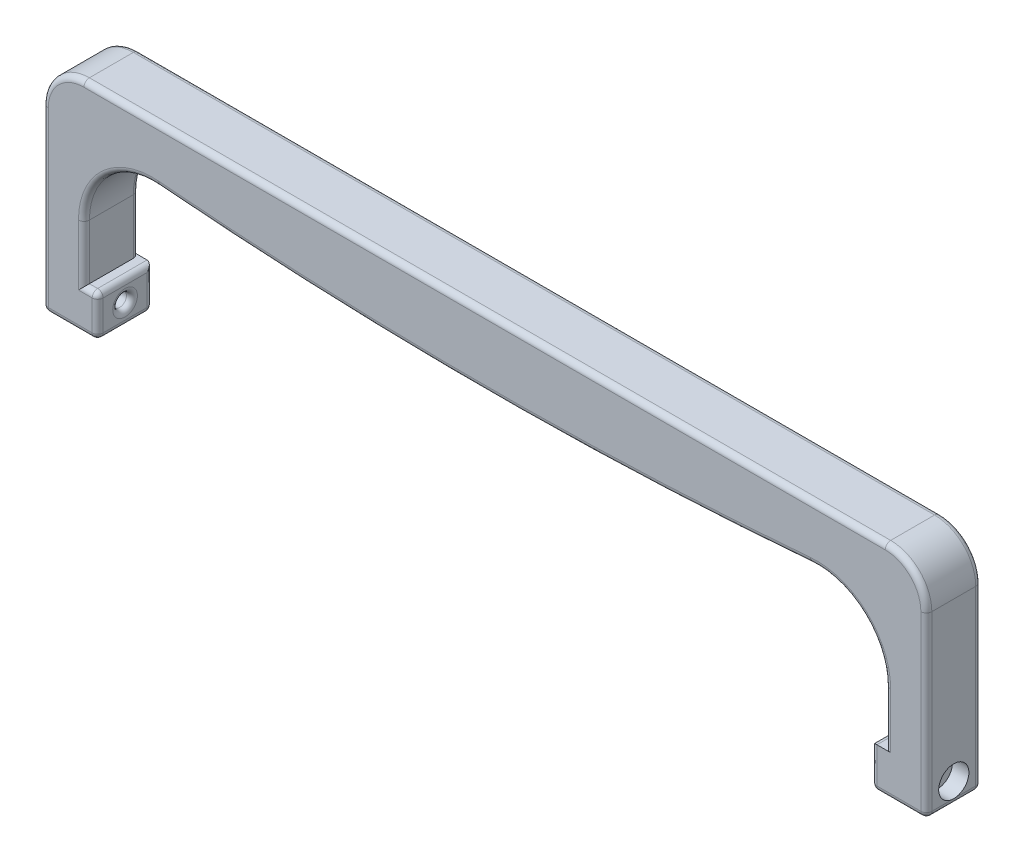
from build123d import *

# Parameters (mm, degrees)
BOSS_EXTRUDE1_DEPTH      = 20
FILLET7_R                = 15
CUT_EXTRUDE3_DEPTH       = 333.39133562714903
CUT_EXTRUDE3_DEPTH_BACK  = 333.39133562714903
SKETCH5_R                = 2.5
SKETCH6_R                = 5.5
CUT_EXTRUDE4_DEPTH       = 6
CUT_EXTRUDE5_START       = -6
SKETCH7_R                = 5.5
CUT_EXTRUDE5_DEPTH       = 6
FILLET2_R                = 2
FILLET3_R                = 2
BOSS_EXTRUDE2_DEPTH      = 1
BOSS_EXTRUDE2_DEPTH_BACK = 10


with BuildPart() as part:
    # Sketch1 → Boss-Extrude1 (new body)
    with BuildSketch(Plane.XY):
        with BuildLine():
            Line((-146.00000000000003, 15), (-146.00000000000003, 35.088261394563546))
            ThreePointArc((-146.00000000000003, 35.088261394563546), (-137.91933959730483, 53.49304195807679), (-118.90112419271411, 60))
            ThreePointArc((-118.90112419271411, 60), (8.672e-14, 55), (118.90112419271411, 60))
            ThreePointArc((118.90112419271411, 60), (137.91933959730483, 53.493041958076795), (146.00000000000003, 35.088261394563546))
            Line((146.00000000000003, 35.088261394563546), (146.00000000000003, 14.999999999999998))
            Line((146.00000000000003, 14.999999999999998), (141, 14.999999999999998))
            Line((141, 14.999999999999998), (141, -6.1e-16))
            Line((141, -6.1e-16), (146.00000000000003, -1.788e-14))
            Line((146.00000000000003, -1.788e-14), (161.00000000000003, -1.223e-14))
            Line((161.00000000000003, -1.223e-14), (161.00000000000003, 28.577779898868368))
            Line((161.00000000000003, 28.577779898868368), (161.00000000000003, 80.00000000000001))
            Line((161.00000000000003, 80.00000000000001), (84.84499999999998, 80.00000000000001))
            Line((84.84499999999998, 80.00000000000001), (-146.00000000000003, 79.99999999999997))
            Line((-146.00000000000003, 79.99999999999997), (-161.00000000000003, 79.99999999999997))
            Line((-161.00000000000003, 79.99999999999997), (-161.00000000000003, 28.577779898868233))
            Line((-161.00000000000003, 28.577779898868233), (-161.00000000000003, -1.223e-14))
            Line((-161.00000000000003, -1.223e-14), (-146.00000000000003, -1.788e-14))
            Line((-146.00000000000003, -1.788e-14), (-141, -1.727e-14))
            Line((-141, -1.727e-14), (-141, 15))
            Line((-141, 15), (-146.00000000000003, 15))
        make_face()
    extrude(amount=BOSS_EXTRUDE1_DEPTH)

    # Fillet7
    fillet7_edges = [part.edges().sort_by_distance(p)[0] for p in [
        (161.00000000000003, 80.00000000000001, 10),
        (-161.00000000000003, 79.99999999999997, 10),
    ]]
    fillet(fillet7_edges, radius=FILLET7_R)

    # Sketch5 → Cut-Extrude3 (cut, two sides: drawn at the far end of the back side and taken through both)
    with BuildSketch(Plane.ZY.offset(161.00000000000003).offset(-CUT_EXTRUDE3_DEPTH_BACK)):
        with Locations((10, 7.499999999999994)):
            Circle(SKETCH5_R)
    extrude(amount=CUT_EXTRUDE3_DEPTH + CUT_EXTRUDE3_DEPTH_BACK, mode=Mode.SUBTRACT)

    # Sketch6 → Cut-Extrude4 (cut)
    with BuildSketch(Plane.ZY.offset(161.00000000000003)):
        with Locations((10, 7.499999999999994)):
            Circle(SKETCH6_R)
    extrude(amount=-CUT_EXTRUDE4_DEPTH, mode=Mode.SUBTRACT)

    # Sketch7 → Cut-Extrude5 (cut)
    with BuildSketch(Plane(origin=(161.00000000000003, 0, 0), x_dir=(0, 0, -1), z_dir=(1, 0, 0)).offset(CUT_EXTRUDE5_START)):
        with Locations((-10, 7.499999999999994)):
            Circle(SKETCH7_R)
    extrude(amount=CUT_EXTRUDE5_DEPTH, mode=Mode.SUBTRACT)

    # Fillet2
    fillet2_edges = [part.edges().sort_by_distance(p)[0] for p in [
        (146.00000000000003, 25.044130697281773, 20),
        (137.91933959730483, 53.49304195807679, 20),
        (3.55e-15, 55, 20),
        (-137.91933959730483, 53.49304195807679, 20),
        (146.00000000000003, 25.044130697281773, 0),
        (137.91933959730483, 53.49304195807679, 0),
        (3.55e-15, 55, 0),
        (-137.91933959730483, 53.49304195807679, 0),
        (161.00000000000003, 32.5, 20),
        (161.00000000000003, 32.5, 0),
        (-146.00000000000003, 25.044130697281773, 20),
        (-146.00000000000003, 25.044130697281773, 0),
        (-161.00000000000003, 32.5, 0),
        (-161.00000000000003, 32.5, 20),
        (156.60660171779824, 75.60660171779823, 0),
        (0, 80, 0),
        (-156.60660171779824, 75.60660171779823, 0),
        (156.60660171779824, 75.60660171779823, 20),
        (0, 80, 20),
        (-156.60660171779824, 75.60660171779823, 20),
    ]]
    fillet(fillet2_edges, radius=FILLET2_R)

    # Fillet3
    fillet3_edges = [part.edges().sort_by_distance(p)[0] for p in [
        (150, -5.84e-15, 0),
        (160.41421356237313, -6.278e-14, 0.5857864376269046),
        (161.00000000000003, -1.223e-14, 10),
        (160.41421356237313, -7.105e-14, 19.414213562373096),
        (-150, -1.5e-14, 0),
        (-160.41421356237313, -1.421e-14, 0.5857864376269049),
        (-161.00000000000003, -1.223e-14, 10),
        (-160.41421356237313, -1.298e-14, 19.414213562373096),
        (141, 14.999999999999998, 10),
        (141, 7.499999999999999, 20),
        (141, -6.1e-16, 10),
        (141, 7.499999999999999, 0),
        (140.99999999999997, 7.499999999999994, 7.5),
        (-141, -1.727e-14, 10),
        (-141, 7.499999999999992, 20),
        (-141, 15, 10),
        (-141, 7.499999999999992, 0),
        (-141, 7.499999999999994, 7.5),
        (144.5, 15, -2.2e-16),
        (150, -5.84e-15, 20),
        (-150, -1.5e-14, 20),
        (-144.5, 15, 20),
    ]]
    fillet(fillet3_edges, radius=FILLET3_R)

    # Sketch8 → Boss-Extrude2 (add, two sides: drawn at the far end of the back side and taken through both)
    # profile 1 of 9: a face of its own
    with BuildSketch(Plane(origin=(1e-17, 1e-17, -0.200000000000006), x_dir=(-1, 0, -5e-17), z_dir=(5e-17, 4e-17, -1)).offset(-BOSS_EXTRUDE2_DEPTH_BACK)):
        with BuildLine():
            Line((-30.517022519889416, 73.74602396791785), (-31.881612061563306, 72.17358700414518))
            Line((-31.881612061563306, 72.17358700414518), (-33.036250841802335, 70.84974614655205))
            Line((-33.036250841802335, 70.84974614655205), (-34.08071072361279, 69.6561283548446))
            ThreePointArc((-34.08071072361279, 69.6561283548446), (-34.09167199181621, 69.64798574838517), (-34.10501822003159, 69.64509963802631))
            ThreePointArc((-34.10501822003159, 69.64509963802631), (-34.11872671725561, 69.64755721049654), (-34.13072778087494, 69.65462382429612))
            Line((-34.13072778087494, 69.65462382429612), (-35.06952265457502, 70.46082136022505))
            Line((-35.06952265457502, 70.46082136022505), (-36.10960574628801, 71.35727611334067))
            Line((-36.10960574628801, 71.35727611334067), (-37.338076283696616, 72.42202461248611))
            Line((-37.338076283696616, 72.42202461248611), (-38.5665683359056, 73.48775835033963))
            Line((-38.5665683359056, 73.48775835033963), (-39.60682239535434, 74.38734433646418))
            Line((-39.60682239535434, 74.38734433646418), (-40.544864829487096, 75.1968540615666))
            ThreePointArc((-40.544864829487096, 75.1968540615666), (-40.55762979171378, 75.20607437847566), (-40.57178971911695, 75.21296313456725))
            ThreePointArc((-40.57178971911695, 75.21296313456725), (-40.58296829963571, 75.21386586393531), (-40.592857953609936, 75.20857716589173))
            ThreePointArc((-40.592857953609936, 75.20857716589173), (-40.606947440180576, 75.19315015471757), (-40.61929940246347, 75.17629977391019))
            ThreePointArc((-40.61929940246347, 75.17629977391019), (-40.63614179688674, 75.1484867485354), (-40.65103916527198, 75.11958520799512))
            Line((-40.65103916527198, 75.11958520799512), (-40.69021223809995, 75.03172925296559))
            Line((-40.69021223809995, 75.03172925296559), (-42.278492497513106, 71.24151479320118))
            Line((-42.278492497513106, 71.24151479320118), (-44.770546020938646, 65.28659821768929))
            Line((-44.770546020938646, 65.28659821768929), (-47.60344758237721, 58.51521112987346))
            ThreePointArc((-47.60344758237721, 58.51521112987346), (-47.612762094503886, 58.49097474351078), (-47.620640209230714, 58.46623413178775))
            ThreePointArc((-47.620640209230714, 58.46623413178775), (-47.622682953143745, 58.45735232131227), (-47.62377639278466, 58.44830446246234))
            ThreePointArc((-47.62377639278466, 58.44830446246234), (-47.62361241781412, 58.44065800603708), (-47.6220999777339, 58.433160825990015))
            ThreePointArc((-47.6220999777339, 58.433160825990015), (-47.61972282359854, 58.427778100172624), (-47.616060205956, 58.423172686943275))
            ThreePointArc((-47.616060205956, 58.423172686943275), (-47.611784824398065, 58.42038253933098), (-47.60677408093159, 58.41940465330618))
            ThreePointArc((-47.60677408093159, 58.41940465330618), (-47.59660378079961, 58.42160996975596), (-47.588260372863886, 58.42782977436996))
            Line((-47.588260372863886, 58.42782977436996), (-46.540995921960246, 59.62994667204537))
            Line((-46.540995921960246, 59.62994667204537), (-45.384897881652215, 60.960250184986876))
            Line((-45.384897881652215, 60.960250184986876), (-44.016900277853416, 62.540398759677835))
            Line((-44.016900277853416, 62.540398759677835), (-42.64929269670946, 64.12055755657687))
            Line((-42.64929269670946, 64.12055755657687), (-41.494434005239654, 65.45085084731224))
            Line((-41.494434005239654, 65.45085084731224), (-40.447338078705364, 66.6546670558046))
            ThreePointArc((-40.447338078705364, 66.6546670558046), (-40.4406855672402, 66.65963221191005), (-40.432573306094135, 66.66139286606227))
            ThreePointArc((-40.432573306094135, 66.66139286606227), (-40.42423280221929, 66.65988919736115), (-40.41694252076583, 66.65556752861187))
            Line((-40.41694252076583, 66.65556752861187), (-39.47078316174019, 65.83657940119984))
            Line((-39.47078316174019, 65.83657940119984), (-38.425880058986, 64.9301596561797))
            Line((-38.425880058986, 64.9301596561797), (-37.188912138769126, 63.85351727229109))
            Line((-37.188912138769126, 63.85351727229109), (-35.60063238779016, 62.47196799344987))
            Line((-35.60063238779016, 62.47196799344987), (-34.66066261288131, 61.662692067863716))
            Line((-34.66066261288131, 61.662692067863716), (-33.97174080184667, 61.07533657193179))
            ThreePointArc((-33.97174080184667, 61.07533657193179), (-33.954050801530904, 61.06936025676506), (-33.93710325766889, 61.077198190879926))
            ThreePointArc((-33.93710325766889, 61.077198190879926), (-33.918071543720195, 61.101328397601385), (-33.9036837807438, 61.1284847097365))
            Line((-33.9036837807438, 61.1284847097365), (-30.41571960064513, 69.44990128602949))
            Line((-30.41571960064513, 69.44990128602949), (-26.926800706983364, 77.77378339228738))
            ThreePointArc((-26.926800706983364, 77.77378339228738), (-26.91857896521943, 77.80058280495462), (-26.915802041310265, 77.82847714578826))
            ThreePointArc((-26.915802041310265, 77.82847714578826), (-26.91628310524661, 77.83212386207289), (-26.917693390287262, 77.83552107538318))
            ThreePointArc((-26.917693390287262, 77.83552107538318), (-26.920050789000157, 77.83878922391445), (-26.92301185429802, 77.84152239346932))
            ThreePointArc((-26.92301185429802, 77.84152239346932), (-26.926812118481564, 77.84389103801517), (-26.93096767425751, 77.84555952266966))
            ThreePointArc((-26.93096767425751, 77.84555952266966), (-26.935605763254234, 77.84659921986893), (-26.940346120254198, 77.84694829768345))
            ThreePointArc((-26.940346120254198, 77.84694829768345), (-26.949504077333067, 77.84496389925708), (-26.95701921565091, 77.8393666936117))
            Line((-26.95701921565091, 77.8393666936117), (-28.001119251599146, 76.6423017891643))
            Line((-28.001119251599146, 76.6423017891643), (-29.153229052668816, 75.31848177739387))
            ThreePointArc((-29.153229052668816, 75.31848177739387), (-29.83537737952861, 74.53247107961056), (-30.517022519889416, 73.74602396791785))
        make_face()
    # profile 2 of 9: a face of its own
    with BuildSketch(Plane(origin=(1e-17, 1e-17, -0.200000000000006), x_dir=(-1, 0, -5e-17), z_dir=(5e-17, 4e-17, -1)).offset(-BOSS_EXTRUDE2_DEPTH_BACK)):
        with BuildLine():
            Line((-25.194575700847825, 71.801086874867), (-25.227873841661587, 70.31216477346783))
            Line((-25.227873841661587, 70.31216477346783), (-26.529654081214108, 67.24914457303491))
            Line((-26.529654081214108, 67.24914457303491), (-27.029758257584028, 66.07227059445927))
            Line((-27.029758257584028, 66.07227059445927), (-27.453071642457253, 65.07575829175823))
            Line((-27.453071642457253, 65.07575829175823), (-27.833703249137812, 64.17951483325015))
            Line((-27.833703249137812, 64.17951483325015), (-27.845171440542106, 64.15164519234153))
            ThreePointArc((-27.845171440542106, 64.15164519234153), (-27.843842865329282, 64.13850452208453), (-27.83231738953594, 64.13205427134237))
            Line((-27.83231738953594, 64.13205427134237), (-27.614904594399732, 64.12546089649939))
            Line((-27.614904594399732, 64.12546089649939), (-27.278222587072563, 64.12212698550762))
            Line((-27.278222587072563, 64.12212698550762), (-26.63139418866299, 64.12488500095293))
            Line((-26.63139418866299, 64.12488500095293), (-25.403879775406466, 64.13260445246493))
            Line((-25.403879775406466, 64.13260445246493), (-25.250700631572183, 64.20782461001262))
            ThreePointArc((-25.250700631572183, 64.20782461001262), (-25.217687602892184, 64.22513663176431), (-25.18563829634145, 64.24417365120999))
            ThreePointArc((-25.18563829634145, 64.24417365120999), (-25.150757396494733, 64.26709676174967), (-25.116768269595287, 64.29132247997522))
            ThreePointArc((-25.116768269595287, 64.29132247997522), (-25.08508546399332, 64.3157754121767), (-25.054363065733263, 64.34142458973103))
            ThreePointArc((-25.054363065733263, 64.34142458973103), (-25.03125292833814, 64.36308417965613), (-25.0098633136667, 64.38644441660595))
            ThreePointArc((-25.0098633136667, 64.38644441660595), (-24.972694312373054, 64.43701386235885), (-24.942874437247095, 64.4922368516694))
            Line((-24.942874437247095, 64.4922368516694), (-24.735598075363207, 64.949285141681))
            Line((-24.735598075363207, 64.949285141681), (-24.45395761738369, 65.58842290877762))
            Line((-24.45395761738369, 65.58842290877762), (-24.039131152275203, 66.55165558837808))
            Line((-24.039131152275203, 66.55165558837808), (-23.699391394080635, 67.34228578177328))
            Line((-23.699391394080635, 67.34228578177328), (-23.410821404231918, 68.00801450417856))
            Line((-23.410821404231918, 68.00801450417856), (-23.149294715694623, 68.60795760336822))
            ThreePointArc((-23.149294715694623, 68.60795760336822), (-23.145665954596673, 68.61235309826671), (-23.1402603727056, 68.61416085016549))
            ThreePointArc((-23.1402603727056, 68.61416085016549), (-23.134825906736065, 68.61276351696985), (-23.13109127866276, 68.60857561611289))
            Line((-23.13109127866276, 68.60857561611289), (-22.835810827794738, 67.96947552926136))
            Line((-22.835810827794738, 67.96947552926136), (-22.51000192961861, 67.26063315383296))
            Line((-22.51000192961861, 67.26063315383296), (-22.126024477118758, 66.41851579526681))
            Line((-22.126024477118758, 66.41851579526681), (-21.620113231339946, 65.31020172525088))
            Line((-21.620113231339946, 65.31020172525088), (-21.322786771247664, 64.67373479049049))
            Line((-21.322786771247664, 64.67373479049049), (-21.113851379945263, 64.23946384284635))
            ThreePointArc((-21.113851379945263, 64.23946384284635), (-21.090737801675647, 64.20472919457747), (-21.059220458224615, 64.17739075364574))
            ThreePointArc((-21.059220458224615, 64.17739075364574), (-21.023863025121436, 64.15991566791031), (-20.985349444572286, 64.15141679678581))
            ThreePointArc((-20.985349444572286, 64.15141679678581), (-20.899319004140487, 64.14440046209126), (-20.813117740797388, 64.13994986308782))
            ThreePointArc((-20.813117740797388, 64.13994986308782), (-20.663197965565555, 64.13568148221127), (-20.51322826317889, 64.13387969228837))
            Line((-20.51322826317889, 64.13387969228837), (-19.83902123766232, 64.13260271930952))
            Line((-19.83902123766232, 64.13260271930952), (-18.68719075434874, 64.13260271930952))
            Line((-18.68719075434874, 64.13260271930952), (-18.51744561560239, 64.22463094003348))
            ThreePointArc((-18.51744561560239, 64.22463094003348), (-18.482303458034874, 64.24457805871911), (-18.44796420994451, 64.26587770244728))
            ThreePointArc((-18.44796420994451, 64.26587770244728), (-18.413338940044188, 64.28917796037776), (-18.37955841050873, 64.31368688037846))
            ThreePointArc((-18.37955841050873, 64.31368688037846), (-18.3500671019475, 64.33673289062989), (-18.321424429720146, 64.36082548693747))
            ThreePointArc((-18.321424429720146, 64.36082548693747), (-18.302919484645656, 64.37877258063936), (-18.286407887883147, 64.3985690029653))
            ThreePointArc((-18.286407887883147, 64.3985690029653), (-18.252048135692686, 64.45071184470648), (-18.224151107950142, 64.5065797635738))
            Line((-18.224151107950142, 64.5065797635738), (-16.713731049154497, 68.04589805331781))
            Line((-16.713731049154497, 68.04589805331781), (-15.222493403982378, 71.54198383737773))
            ThreePointArc((-15.222493403982378, 71.54198383737773), (-15.181801611077226, 71.64674736599228), (-15.148018691453188, 71.75393847233644))
            ThreePointArc((-15.148018691453188, 71.75393847233644), (-15.151158888249334, 71.7734864005924), (-15.168063420864131, 71.783792666264))
            ThreePointArc((-15.168063420864131, 71.783792666264), (-15.238167294449251, 71.79047082211542), (-15.308486134481148, 71.79426708261528))
            ThreePointArc((-15.308486134481148, 71.79426708261528), (-15.449595441491912, 71.79761169652794), (-15.590743095009977, 71.79821408645769))
            Line((-15.590743095009977, 71.79821408645769), (-16.34889072420355, 71.79408421360422))
            Line((-16.34889072420355, 71.79408421360422), (-17.56328330351177, 71.78588367616983))
            Line((-17.56328330351177, 71.78588367616983), (-17.695506951477714, 71.72032302176873))
            ThreePointArc((-17.695506951477714, 71.72032302176873), (-17.802334592565398, 71.65585034668128), (-17.89708974002304, 71.57466948216523))
            ThreePointArc((-17.89708974002304, 71.57466948216523), (-17.981687678970637, 71.47563359681875), (-18.051028752355027, 71.3653760192903))
            ThreePointArc((-18.051028752355027, 71.3653760192903), (-18.15301148573282, 71.16310087263345), (-18.246144045493562, 70.95660138310706))
            Line((-18.246144045493562, 70.95660138310706), (-18.80587480530798, 69.63171799428814))
            Line((-18.80587480530798, 69.63171799428814), (-19.098449411319155, 68.93682470223517))
            Line((-19.098449411319155, 68.93682470223517), (-19.349111607329487, 68.34620701131271))
            Line((-19.349111607329487, 68.34620701131271), (-19.573236313915658, 67.82104320358061))
            ThreePointArc((-19.573236313915658, 67.82104320358061), (-19.580906661893607, 67.80594189575936), (-19.590508015688652, 67.79198848250965))
            ThreePointArc((-19.590508015688652, 67.79198848250965), (-19.597563453819166, 67.78475721913398), (-19.60596045912192, 67.77913932992473))
            ThreePointArc((-19.60596045912192, 67.77913932992473), (-19.61842512099299, 67.77321753446356), (-19.631343535002443, 67.76836469647692))
            ThreePointArc((-19.631343535002443, 67.76836469647692), (-19.646310856300243, 67.76409369402741), (-19.661567253654688, 67.76101075573439))
            ThreePointArc((-19.661567253654688, 67.76101075573439), (-19.676924496648894, 67.75915782715414), (-19.692380729379, 67.75853885502275))
            ThreePointArc((-19.692380729379, 67.75853885502275), (-19.707631947234653, 67.75915813035074), (-19.72278274792565, 67.76101187964183))
            ThreePointArc((-19.72278274792565, 67.76101187964183), (-19.737441351992313, 67.76406456497033), (-19.751783681995633, 67.76836469647692))
            ThreePointArc((-19.751783681995633, 67.76836469647692), (-19.763833163830295, 67.77319631286137), (-19.77537508878884, 67.77913924964562))
            ThreePointArc((-19.77537508878884, 67.77913924964562), (-19.7828236579285, 67.7847441273493), (-19.78869010102561, 67.79198848250968))
            ThreePointArc((-19.78869010102561, 67.79198848250968), (-19.796630266415477, 67.80567672714416), (-19.80366361759115, 67.81985227788589))
            Line((-19.80366361759115, 67.81985227788589), (-20.05978520350341, 68.38121592626077))
            Line((-20.05978520350341, 68.38121592626077), (-20.346168765141424, 69.01029763818704))
            Line((-20.346168765141424, 69.01029763818704), (-20.682237627416974, 69.75089735754851))
            Line((-20.682237627416974, 69.75089735754851), (-21.12514652658429, 70.72349435402307))
            Line((-21.12514652658429, 70.72349435402307), (-21.38734841592241, 71.28423668409354))
            Line((-21.38734841592241, 71.28423668409354), (-21.570183945967244, 71.66127414168082))
            ThreePointArc((-21.570183945967244, 71.66127414168082), (-21.595062868386215, 71.69963456532909), (-21.628220762277998, 71.73111530477189))
            ThreePointArc((-21.628220762277998, 71.73111530477189), (-21.66998415002099, 71.75429229930907), (-21.716412578326246, 71.76550633857477))
            ThreePointArc((-21.716412578326246, 71.76550633857477), (-21.819651831155575, 71.77432283065916), (-21.923130901559073, 71.77962903889673))
            ThreePointArc((-21.923130901559073, 71.77962903889673), (-22.124276987158, 71.78506234589283), (-22.325480700731596, 71.787579133703))
            Line((-22.325480700731596, 71.787579133703), (-23.44805911531989, 71.79348329286458))
            Line((-23.44805911531989, 71.79348329286458), (-25.194575700847825, 71.801086874867))
        make_face()
    # profile 3 of 9: a face of its own
    with BuildSketch(Plane(origin=(1e-17, 1e-17, -0.200000000000006), x_dir=(-1, 0, -5e-17), z_dir=(5e-17, 4e-17, -1)).offset(-BOSS_EXTRUDE2_DEPTH_BACK)):
        with BuildLine():
            Line((13.591695963639955, 71.77919749215903), (12.447718703588956, 71.77192524878659))
            Line((12.447718703588956, 71.77192524878659), (12.447718703588956, 70.75053054422978))
            Line((12.447718703588956, 70.75053054422978), (11.972733993274915, 70.26115082686665))
            Line((11.972733993274915, 70.26115082686665), (11.660281424315405, 69.94210538984893))
            Line((11.660281424315405, 69.94210538984893), (10.807976165527528, 69.08017284659554))
            Line((10.807976165527528, 69.08017284659554), (9.790523593228734, 68.05288065159617))
            Line((9.790523593228734, 68.05288065159617), (8.674600723068465, 66.92801431439536))
            Line((8.674600723068465, 66.92801431439536), (5.851452163175836, 64.08425749252741))
            Line((5.851452163175836, 64.08425749252741), (7.400482950812076, 64.10210717710366))
            Line((7.400482950812076, 64.10210717710366), (8.36695684579713, 64.11442838752798))
            ThreePointArc((8.36695684579713, 64.11442838752798), (8.55526748242397, 64.11841334201456), (8.7435014164332, 64.12510376924116))
            ThreePointArc((8.7435014164332, 64.12510376924116), (8.847707326239451, 64.13137977804593), (8.951630966070205, 64.14128619058498))
            ThreePointArc((8.951630966070205, 64.14128619058498), (9.012300957283168, 64.15285842478418), (9.070519291185743, 64.17348341049934))
            ThreePointArc((9.070519291185743, 64.17348341049934), (9.108676622407918, 64.19306853164028), (9.14432329854419, 64.21691959821055))
            ThreePointArc((9.14432329854419, 64.21691959821055), (9.19866630479621, 64.259312445817), (9.25170746721627, 64.30332325069284))
            ThreePointArc((9.25170746721627, 64.30332325069284), (9.320097967131854, 64.3633362942388), (9.386959109263472, 64.42504863941551))
            Line((9.386959109263472, 64.42504863941551), (9.554919536442602, 64.58789287917163))
            Line((9.554919536442602, 64.58789287917163), (9.918314228962938, 64.94877585254392))
            Line((9.918314228962938, 64.94877585254392), (14.288644106448695, 64.94877585254392))
            Line((14.288644106448695, 64.94877585254392), (14.319315836032182, 64.76814786411481))
            Line((14.319315836032182, 64.76814786411481), (14.333123494382422, 64.68680982321904))
            Line((14.333123494382422, 64.68680982321904), (14.349330989567028, 64.59129007685868))
            Line((14.349330989567028, 64.59129007685868), (14.3653259591987, 64.49698875324914))
            Line((14.3653259591987, 64.49698875324914), (14.37842419108914, 64.4197266431217))
            ThreePointArc((14.37842419108914, 64.4197266431217), (14.384964370107918, 64.38527716331966), (14.3928589898159, 64.35111262644446))
            ThreePointArc((14.3928589898159, 64.35111262644446), (14.402111766836992, 64.31721006116805), (14.412686510725907, 64.28369629374916))
            ThreePointArc((14.412686510725907, 64.28369629374916), (14.42308982225022, 64.25476125309966), (14.43463594220495, 64.22626296223774))
            ThreePointArc((14.43463594220495, 64.22626296223774), (14.443710759495143, 64.2085595506785), (14.455129511401678, 64.1922692101485))
            Line((14.455129511401678, 64.1922692101485), (14.503398207631019, 64.1326049418641))
            Line((14.503398207631019, 64.1326049418641), (15.951798841579375, 64.10904315806084))
            Line((15.951798841579375, 64.10904315806084), (16.508385068814576, 64.10126876888064))
            Line((16.508385068814576, 64.10126876888064), (16.979872152279583, 64.09754301557255))
            Line((16.979872152279583, 64.09754301557255), (17.400693780742934, 64.09597010704934))
            ThreePointArc((17.400693780742934, 64.09597010704934), (17.40989642937089, 64.09777667091026), (17.41769855371504, 64.10298044554716))
            ThreePointArc((17.41769855371504, 64.10298044554716), (17.42588420289553, 64.11646477561366), (17.426924000508325, 64.13220487824272))
            Line((17.426924000508325, 64.13220487824272), (16.759811494385712, 67.93083593167952))
            Line((16.759811494385712, 67.93083593167952), (16.096046880586467, 71.7092319690623))
            ThreePointArc((16.096046880586467, 71.7092319690623), (16.086078488718094, 71.74547002103996), (16.069478938621607, 71.77918975093465))
            ThreePointArc((16.069478938621607, 71.77918975093465), (16.063459353359256, 71.78502337591586), (16.05538379137816, 71.78727101597646))
            Line((16.05538379137816, 71.78727101597646), (15.86666290321936, 71.7914855473126))
            Line((15.86666290321936, 71.7914855473126), (15.650595756979687, 71.79387069307028))
            Line((15.650595756979687, 71.79387069307028), (15.396396570599208, 71.79286463531434))
            Line((15.396396570599208, 71.79286463531434), (15.064684294846082, 71.78991049801323))
            Line((15.064684294846082, 71.78991049801323), (14.593717393227784, 71.78621201284149))
            Line((14.593717393227784, 71.78621201284149), (14.078109661985744, 71.7824503747704))
            ThreePointArc((14.078109661985744, 71.7824503747704), (13.8349030811757, 71.78078380433453), (13.591695963639955, 71.77919749215903))
        make_face()
        Polygon((11.795917416419847, 66.76685170737503), (14.007034074707363, 66.78850536510332), (13.656683906898998, 68.70595567427992), align=None, mode=Mode.SUBTRACT)
    # profile 4 of 9: a face of its own
    with BuildSketch(Plane(origin=(1e-17, 1e-17, -0.200000000000006), x_dir=(-1, 0, -5e-17), z_dir=(5e-17, 4e-17, -1)).offset(-BOSS_EXTRUDE2_DEPTH_BACK)):
        with BuildLine():
            Line((-3.5813427881241693, 71.79925382188529), (-3.5813427881241693, 70.28774997064427))
            Line((-3.5813427881241693, 70.28774997064427), (-4.877979732675458, 67.25031699585685))
            Line((-4.877979732675458, 67.25031699585685), (-5.3763898861101165, 66.08233168045422))
            Line((-5.3763898861101165, 66.08233168045422), (-5.798977842222724, 65.09105614439339))
            Line((-5.798977842222724, 65.09105614439339), (-6.177187776152509, 64.2032870285901))
            Line((-6.177187776152509, 64.2032870285901), (-6.192483113375063, 64.16497310275473))
            ThreePointArc((-6.192483113375063, 64.16497310275473), (-6.190705649727166, 64.14603885998419), (-6.174757914932497, 64.13567861475386))
            ThreePointArc((-6.174757914932497, 64.13567861475386), (-6.1086070238087595, 64.1288432395458), (-6.042214702605358, 64.125006256887))
            ThreePointArc((-6.042214702605358, 64.125006256887), (-5.9071183408160834, 64.12162797848708), (-5.771981292733624, 64.12098147310789))
            Line((-5.771981292733624, 64.12098147310789), (-5.049714421784168, 64.12482726198917))
            Line((-5.049714421784168, 64.12482726198917), (-3.889079327523382, 64.13259865408278))
            Line((-3.889079327523382, 64.13259865408278), (-3.755280817576168, 64.2033940413871))
            ThreePointArc((-3.755280817576168, 64.2033940413871), (-3.699406400792971, 64.23470642769355), (-3.6451074048865815, 64.26867751879503))
            ThreePointArc((-3.6451074048865815, 64.26867751879503), (-3.5998197471671904, 64.3010000361789), (-3.557023912111799, 64.33655609858255))
            ThreePointArc((-3.557023912111799, 64.33655609858255), (-3.521239650676727, 64.37136341849381), (-3.4884723258194166, 64.40902460949403))
            ThreePointArc((-3.4884723258194166, 64.40902460949403), (-3.460868420746576, 64.44727453405157), (-3.4371631929456137, 64.48805558944294))
            Line((-3.4371631929456137, 64.48805558944294), (-3.409467918255349, 64.54584985581414))
            Line((-3.409467918255349, 64.54584985581414), (-3.318231303035424, 64.75281624148467))
            Line((-3.318231303035424, 64.75281624148467), (-3.2109203489080085, 64.99858497107138))
            Line((-3.2109203489080085, 64.99858497107138), (-3.0917134763003173, 65.27445352189017))
            Line((-3.0917134763003173, 65.27445352189017), (-2.9019840850691314, 65.72492864651582))
            ThreePointArc((-2.9019840850691314, 65.72492864651582), (-2.8491326953495983, 65.85951366505039), (-2.8008210119158, 65.995794176691))
            ThreePointArc((-2.8008210119158, 65.995794176691), (-2.755413170208824, 66.13831867144108), (-2.7144423262354724, 66.2821814311684))
            Line((-2.7144423262354724, 66.2821814311684), (-2.5766374607449394, 66.80856885303318))
            Line((-2.5766374607449394, 66.80856885303318), (-2.364693476147821, 67.63811961470786))
            Line((-2.364693476147821, 67.63811961470786), (-2.3424242929896466, 67.49094125376557))
            Line((-2.3424242929896466, 67.49094125376557), (-2.1758864650846577, 66.41743944202157))
            Line((-2.1758864650846577, 66.41743944202157), (-2.001020215129883, 65.34320759884763))
            Line((-2.001020215129883, 65.34320759884763), (-1.8276570041161944, 64.30618731558566))
            ThreePointArc((-1.8276570041161944, 64.30618731558566), (-1.8173951976639475, 64.26870925272512), (-1.7998187255780627, 64.23405413049973))
            ThreePointArc((-1.7998187255780627, 64.23405413049973), (-1.7604312330875496, 64.19188587537234), (-1.708668945591356, 64.16638681855957))
            ThreePointArc((-1.708668945591356, 64.16638681855957), (-1.6198551911607975, 64.14589197435788), (-1.5294378403657962, 64.13437571237247))
            ThreePointArc((-1.5294378403657962, 64.13437571237247), (-1.3619581090792952, 64.12473068515978), (-1.1942321657957804, 64.12149110318245))
            Line((-1.1942321657957804, 64.12149110318245), (-0.37017851590375916, 64.12428329076717))
            Line((-0.37017851590375916, 64.12428329076717), (0.41207915545210905, 64.13086154802808))
            ThreePointArc((0.41207915545210905, 64.13086154802808), (0.5477746530905232, 64.13366340445361), (0.6833778716831017, 64.13939800000159))
            ThreePointArc((0.6833778716831017, 64.13939800000159), (0.7582992716286386, 64.14583260846304), (0.8326422316747322, 64.15713502623252))
            ThreePointArc((0.8326422316747322, 64.15713502623252), (0.8881703384418675, 64.17163308361359), (0.9410468815816485, 64.19394082878323))
            ThreePointArc((0.9410468815816485, 64.19394082878323), (0.9925005222128965, 64.22495352611288), (1.0390259901679963, 64.26296201676207))
            Line((1.0390259901679963, 64.26296201676207), (1.389463402710478, 64.5935531442508))
            Line((1.389463402710478, 64.5935531442508), (1.8582262682340311, 65.04591076039196))
            Line((1.8582262682340311, 65.04591076039196), (2.5198721023482418, 65.69653432677647))
            Line((2.5198721023482418, 65.69653432677647), (3.0795188634599957, 66.2487913961835))
            Line((3.0795188634599957, 66.2487913961835), (3.5515926801505615, 66.7128167240667))
            Line((3.5515926801505615, 66.7128167240667), (3.9793880742699743, 67.13226828254759))
            ThreePointArc((3.9793880742699743, 67.13226828254759), (3.9817522029285493, 67.13325188649087), (3.9841411325376113, 67.13233015097865))
            ThreePointArc((3.9841411325376113, 67.13233015097865), (3.985534002563709, 67.12987901713493), (3.985273983430293, 67.127071788238))
            Line((3.985273983430293, 67.127071788238), (3.822937262517812, 66.73978512496925))
            Line((3.822937262517812, 66.73978512496925), (3.6425371597108573, 66.31143679512768))
            Line((3.6425371597108573, 66.31143679512768), (3.4271256261699805, 65.80367174423355))
            Line((3.4271256261699805, 65.80367174423355), (3.2103453338723225, 65.29051838650655))
            Line((3.2103453338723225, 65.29051838650655), (3.025321770034673, 64.8446927333418))
            Line((3.025321770034673, 64.8446927333418), (2.8673039636462065, 64.45838376152723))
            ThreePointArc((2.8673039636462065, 64.45838376152723), (2.856866473628086, 64.42825000603301), (2.849710984891495, 64.39717295020392))
            ThreePointArc((2.849710984891495, 64.39717295020392), (2.8459737771429934, 64.36029155741308), (2.847549657280831, 64.32325481271623))
            ThreePointArc((2.847549657280831, 64.32325481271623), (2.854536894716425, 64.28994482065688), (2.867531367593875, 64.25848817219249))
            ThreePointArc((2.867531367593875, 64.25848817219249), (2.886447157435822, 64.22921594644924), (2.910271107300992, 64.20377798823459))
            ThreePointArc((2.910271107300992, 64.20377798823459), (2.941141305510164, 64.17953024661185), (2.9748081495817034, 64.15934446643027))
            ThreePointArc((2.9748081495817034, 64.15934446643027), (3.013686618384881, 64.14397825341793), (3.05485540949222, 64.13671282310851))
            ThreePointArc((3.05485540949222, 64.13671282310851), (3.1490113049177655, 64.13084194852084), (3.2432776963198027, 64.12714772819061))
            ThreePointArc((3.2432776963198027, 64.12714772819061), (3.400427041011167, 64.12396335287512), (3.557606227428047, 64.123091492563))
            Line((3.557606227428047, 64.123091492563), (4.195740639497882, 64.12561784926824))
            Line((4.195740639497882, 64.12561784926824), (5.3379594124926895, 64.13259568239926))
            Line((5.3379594124926895, 64.13259568239926), (6.966141946612471, 67.95427401244514))
            Line((6.966141946612471, 67.95427401244514), (7.590452564231833, 69.42059334424083))
            Line((7.590452564231833, 69.42059334424083), (8.116045838421716, 70.65715205509498))
            Line((8.116045838421716, 70.65715205509498), (8.592238508442907, 71.77869836958955))
            ThreePointArc((8.592238508442907, 71.77869836958955), (8.593797679219595, 71.78371855670423), (8.594324453972769, 71.78894883399484))
            ThreePointArc((8.594324453972769, 71.78894883399484), (8.592776350671636, 71.79269634586389), (8.589034740213258, 71.7942586583222))
            Line((8.589034740213258, 71.7942586583222), (8.191465489548227, 71.79576664419359))
            Line((8.191465489548227, 71.79576664419359), (7.748767456832544, 71.7960559700915))
            Line((7.748767456832544, 71.7960559700915), (7.222889727011166, 71.79390791529342))
            Line((7.222889727011166, 71.79390791529342), (5.851455000048727, 71.78587045148296))
            Line((5.851455000048727, 71.78587045148296), (5.717656490101069, 71.72164125281408))
            ThreePointArc((5.717656490101069, 71.72164125281408), (5.650411941379322, 71.68248698334438), (5.590236810554121, 71.63315302160738))
            Line((5.590236810554121, 71.63315302160738), (5.118193951781562, 71.17867414883592))
            Line((5.118193951781562, 71.17867414883592), (4.407638634309567, 70.48049123309801))
            Line((4.407638634309567, 70.48049123309801), (3.128651934276886, 69.20657220514913))
            Line((3.128651934276886, 69.20657220514913), (2.1871517452508296, 68.26867215938996))
            Line((2.1871517452508296, 68.26867215938996), (1.3946650440109487, 67.48355312661967))
            Line((1.3946650440109487, 67.48355312661967), (0.6812469468600846, 66.77932524772166))
            ThreePointArc((0.6812469468600846, 66.77932524772166), (0.6762628656051495, 66.7783593535333), (0.6734492767393898, 66.78258519489725))
            ThreePointArc((0.6734492767393898, 66.78258519489725), (0.6729909398807197, 66.79334769261679), (0.6716192697935472, 66.80403225863563))
            Line((0.6716192697935472, 66.80403225863563), (0.5984228868900628, 67.22983047713194))
            Line((0.5984228868900628, 67.22983047713194), (0.515960563875609, 67.70651022724871))
            Line((0.515960563875609, 67.70651022724871), (0.4180402581690642, 68.26740920861468))
            Line((0.4180402581690642, 68.26740920861468), (0.29118803166362806, 69.00887594232063))
            Line((0.29118803166362806, 69.00887594232063), (0.19606855692556902, 69.6063205951743))
            Line((0.19606855692556902, 69.6063205951743), (0.12125838477207462, 70.1319558285764))
            Line((0.12125838477207462, 70.1319558285764), (0.05741059213561239, 70.6485866363366))
            Line((0.05741059213561239, 70.6485866363366), (0.01596345307321189, 71.01053218395548))
            Line((0.01596345307321189, 71.01053218395548), (-0.0214974269820837, 71.33401132895706))
            Line((-0.0214974269820837, 71.33401132895706), (-0.05339560722682193, 71.60662258181083))
            Line((-0.05339560722682193, 71.60662258181083), (-0.0634558369107944, 71.6855250884299))
            Line((-0.0634558369107944, 71.6855250884299), (-0.07910167271039917, 71.79925382188529))
            Line((-0.07910167271039917, 71.79925382188529), (-3.5813427881241693, 71.79925382188529))
        make_face()
    # profile 5 of 9: a face of its own
    with BuildSketch(Plane(origin=(1e-17, 1e-17, -0.200000000000006), x_dir=(-1, 0, -5e-17), z_dir=(5e-17, 4e-17, -1)).offset(-BOSS_EXTRUDE2_DEPTH_BACK)):
        with BuildLine():
            Line((20.510708357275607, 71.77371526642256), (20.479991189718515, 70.25525294267914))
            Line((20.479991189718515, 70.25525294267914), (19.18976196284879, 67.22068876850533))
            Line((19.18976196284879, 67.22068876850533), (18.69414945597699, 66.05382703946754))
            Line((18.69414945597699, 66.05382703946754), (18.27469225119923, 65.0635782999324))
            Line((18.27469225119923, 65.0635782999324), (17.899473757594894, 64.1761347694229))
            ThreePointArc((17.899473757594894, 64.1761347694229), (17.89234388264127, 64.15759921427897), (17.886442291160296, 64.1386368004205))
            ThreePointArc((17.886442291160296, 64.1386368004205), (17.890604775896996, 64.11664096070149), (17.91054579772999, 64.10646752016333))
            Line((17.91054579772999, 64.10646752016333), (18.383931852992582, 64.09901142745957))
            Line((18.383931852992582, 64.09901142745957), (19.194480202408435, 64.0950496000607))
            Line((19.194480202408435, 64.0950496000607), (21.45575516582898, 64.09902989165391))
            Line((21.45575516582898, 64.09902989165391), (25.038158489650183, 64.10691110556452))
            Line((25.038158489650183, 64.10691110556452), (25.310852429982987, 64.17916883030347))
            ThreePointArc((25.310852429982987, 64.17916883030347), (25.692255155461492, 64.29940635969623), (26.060885666808076, 64.45444393121122))
            ThreePointArc((26.060885666808076, 64.45444393121122), (26.413020947041364, 64.64274472859677), (26.746117689573786, 64.86297870870725))
            ThreePointArc((26.746117689573786, 64.86297870870725), (27.039204686250905, 65.09993916537923), (27.307624035895802, 65.3645167501887))
            ThreePointArc((27.307624035895802, 65.3645167501887), (27.51750101985575, 65.62706608602602), (27.68920927807672, 65.9160241733042))
            ThreePointArc((27.68920927807672, 65.9160241733042), (27.77234122721372, 66.08802040058406), (27.849633639003184, 66.26271872984222))
            Line((27.849633639003184, 66.26271872984222), (28.584835976158573, 68.00308129072879))
            Line((28.584835976158573, 68.00308129072879), (29.34003838461663, 69.79639880213627))
            ThreePointArc((29.34003838461663, 69.79639880213627), (29.384292789542744, 69.91023493250921), (29.42225328742698, 70.0263216136317))
            ThreePointArc((29.42225328742698, 70.0263216136317), (29.46384845397432, 70.20428426712039), (29.484179786980157, 70.38590888223366))
            ThreePointArc((29.484179786980157, 70.38590888223366), (29.48092113582129, 70.55736525069857), (29.45328961794948, 70.72661182914152))
            ThreePointArc((29.45328961794948, 70.72661182914152), (29.402439612322183, 70.88748715668733), (29.3287583745879, 71.03926880673505))
            ThreePointArc((29.3287583745879, 71.03926880673505), (29.23128286413092, 71.18486706303413), (29.115722487110457, 71.3165717578596))
            ThreePointArc((29.115722487110457, 71.3165717578596), (29.048679296921435, 71.37927533785384), (28.977587433656943, 71.4373483545862))
            ThreePointArc((28.977587433656943, 71.4373483545862), (28.902538949535586, 71.4907284524602), (28.82411567248163, 71.539014055222))
            ThreePointArc((28.82411567248163, 71.539014055222), (28.738384772836426, 71.58446225125176), (28.649982852438328, 71.62446757772544))
            ThreePointArc((28.649982852438328, 71.62446757772544), (28.55076275447259, 71.66295242992862), (28.449830088660274, 71.69669126010174))
            Line((28.449830088660274, 71.69669126010174), (28.249322732725922, 71.75847087967234))
            Line((28.249322732725922, 71.75847087967234), (20.510708357275607, 71.77371526642256))
        make_face()
        Polygon((21.91507554496841, 66.119024670763), (24.68993419649035, 66.11366227408712), (24.943005390434504, 66.21972896319012), (26.46329629055134, 69.61036860771182), (26.301327932501266, 69.77649508027042), (23.068589485554455, 69.79228191264417), (21.6090577561554, 66.32722513861208), (21.688858078061596, 66.14230563248555), align=None, mode=Mode.SUBTRACT)
    # profile 6 of 9: a face of its own
    with BuildSketch(Plane(origin=(1e-17, 1e-17, -0.200000000000006), x_dir=(-1, 0, -5e-17), z_dir=(5e-17, 4e-17, -1)).offset(-BOSS_EXTRUDE2_DEPTH_BACK)):
        with BuildLine():
            Line((31.112719083407733, 71.7159522942792), (31.010052356694292, 71.47174591010588))
            Line((31.010052356694292, 71.47174591010588), (30.891909530116997, 71.18911713605262))
            Line((30.891909530116997, 71.18911713605262), (30.756421064709546, 70.86266999222437))
            Line((30.756421064709546, 70.86266999222437), (30.618808467677724, 70.53051848272298))
            Line((30.618808467677724, 70.53051848272298), (30.49396683138128, 70.22994211034376))
            Line((30.49396683138128, 70.22994211034376), (30.388978057433565, 69.97776986435014))
            Line((30.388978057433565, 69.97776986435014), (30.352849088025156, 69.89239255347799))
            Line((30.352849088025156, 69.89239255347799), (30.298137619601427, 69.76504572740109))
            Line((30.298137619601427, 69.76504572740109), (33.08923688721221, 69.77890206164942))
            Line((33.08923688721221, 69.77890206164942), (33.5253723706117, 70.76901103526103))
            Line((33.5253723706117, 70.76901103526103), (33.69261817995261, 71.15005284141371))
            Line((33.69261817995261, 71.15005284141371), (33.833541594353136, 71.47417098133904))
            Line((33.833541594353136, 71.47417098133904), (33.95861430067581, 71.76372366772391))
            ThreePointArc((33.95861430067581, 71.76372366772391), (33.961055271357246, 71.77129378566876), (33.962013505340444, 71.77918978536482))
            ThreePointArc((33.962013505340444, 71.77918978536482), (33.959776080431276, 71.78495608956992), (33.95410359859199, 71.78742171001775))
            Line((33.95410359859199, 71.78742171001775), (33.549962423602004, 71.79336405552326))
            Line((33.549962423602004, 71.79336405552326), (33.09688400812741, 71.79781737836858))
            Line((33.09688400812741, 71.79781737836858), (32.5585763164529, 71.79925953898788))
            Line((32.5585763164529, 71.79925953898788), (31.69700286164037, 71.79815342670612))
            ThreePointArc((31.69700286164037, 71.79815342670612), (31.52933262262207, 71.79645689590326), (31.361707113914754, 71.79222888220507))
            ThreePointArc((31.361707113914754, 71.79222888220507), (31.267942718327756, 71.78804978242455), (31.174302698684183, 71.78166437124572))
            ThreePointArc((31.174302698684183, 71.78166437124572), (31.148374476120747, 71.77274411105418), (31.12995755136334, 71.75243006050624))
            ThreePointArc((31.12995755136334, 71.75243006050624), (31.120941637289235, 71.73437863835419), (31.112719083407733, 71.7159522942792))
        make_face()
    # profile 7 of 9: a face of its own
    with BuildSketch(Plane(origin=(1e-17, 1e-17, -0.200000000000006), x_dir=(-1, 0, -5e-17), z_dir=(5e-17, 4e-17, -1)).offset(-BOSS_EXTRUDE2_DEPTH_BACK)):
        with BuildLine():
            Line((30.027518251924732, 69.01625055494856), (30.00368895138061, 68.95604122547219))
            Line((30.00368895138061, 68.95604122547219), (29.984149819779258, 68.9083889664335))
            Line((29.984149819779258, 68.9083889664335), (29.694368685818425, 68.2257104079507))
            Line((29.694368685818425, 68.2257104079507), (29.367580944502865, 67.45632621374861))
            Line((29.367580944502865, 67.45632621374861), (28.984146285798705, 66.55435797191409))
            Line((28.984146285798705, 66.55435797191409), (28.601453298994215, 65.65225673436085))
            Line((28.601453298994215, 65.65225673436085), (28.276958837380125, 64.88249177635916))
            Line((28.276958837380125, 64.88249177635916), (27.990069035700223, 64.19886022460943))
            ThreePointArc((27.990069035700223, 64.19886022460943), (27.981407232698757, 64.17523876395241), (27.9749354999887, 64.15092586798059))
            Line((27.9749354999887, 64.15092586798059), (27.961438081269826, 64.08896757471335))
            Line((27.961438081269826, 64.08896757471335), (30.36333918556133, 64.10584523987453))
            Line((30.36333918556133, 64.10584523987453), (30.527272170555396, 64.18160107313666))
            ThreePointArc((30.527272170555396, 64.18160107313666), (30.63979679771131, 64.24712549383736), (30.738019220442723, 64.33260997837995))
            ThreePointArc((30.738019220442723, 64.33260997837995), (30.830185925626818, 64.44404768213093), (30.906105792859684, 64.56712991935923))
            ThreePointArc((30.906105792859684, 64.56712991935923), (31.026718097453532, 64.80777045954977), (31.138143984565133, 65.05279998692154))
            Line((31.138143984565133, 65.05279998692154), (31.85088674537359, 66.70223606410542))
            Line((31.85088674537359, 66.70223606410542), (32.222429258715515, 67.56618064259185))
            Line((32.222429258715515, 67.56618064259185), (32.53746697544532, 68.29908424490122))
            Line((32.53746697544532, 68.29908424490122), (32.81970971403755, 68.95590530474738))
            Line((32.81970971403755, 68.95590530474738), (32.830893423050206, 68.98279698558713))
            ThreePointArc((32.830893423050206, 68.98279698558713), (32.82963477243351, 68.99552585210623), (32.81847016903171, 69.00176763671612))
            Line((32.81847016903171, 69.00176763671612), (32.555927533233216, 69.00946565926883))
            Line((32.555927533233216, 69.00946565926883), (32.162998451983995, 69.01490389970557))
            Line((32.162998451983995, 69.01490389970557), (31.43592792951399, 69.01625055494856))
            Line((31.43592792951399, 69.01625055494856), (30.027518251924732, 69.01625055494856))
        make_face()
    # profile 8 of 9: a face of its own
    with BuildSketch(Plane(origin=(1e-17, 1e-17, -0.200000000000006), x_dir=(-1, 0, -5e-17), z_dir=(5e-17, 4e-17, -1)).offset(-BOSS_EXTRUDE2_DEPTH_BACK)):
        with BuildLine():
            Line((34.0021039810312, 69.37175089454486), (33.40146965197976, 67.97262217735798))
            Line((33.40146965197976, 67.97262217735798), (33.068356264990044, 67.18677078506344))
            Line((33.068356264990044, 67.18677078506344), (32.78054183532708, 66.49858071807977))
            Line((32.78054183532708, 66.49858071807977), (32.53634539879057, 65.90793784627787))
            ThreePointArc((32.53634539879057, 65.90793784627787), (32.514730917752956, 65.85044137611035), (32.496752038083656, 65.7917064652133))
            ThreePointArc((32.496752038083656, 65.7917064652133), (32.47504830185244, 65.69602425665278), (32.461588879839624, 65.59883896372995))
            ThreePointArc((32.461588879839624, 65.59883896372995), (32.454335386555684, 65.48802794323296), (32.453635548531864, 65.37698198132915))
            ThreePointArc((32.453635548531864, 65.37698198132915), (32.45934272978936, 65.26972975834661), (32.471456412909376, 65.16301110986441))
            ThreePointArc((32.471456412909376, 65.16301110986441), (32.488615064293654, 65.07816159848586), (32.51524416958527, 64.99579200670667))
            ThreePointArc((32.51524416958527, 64.99579200670667), (32.59801534949242, 64.82341792902983), (32.706692791390154, 64.6660867353627))
            ThreePointArc((32.706692791390154, 64.6660867353627), (32.842536087690156, 64.52110320243352), (32.99727069547753, 64.39648046324375))
            ThreePointArc((32.99727069547753, 64.39648046324375), (33.17836231661119, 64.28716786016537), (33.37209352012804, 64.2022464775783))
            ThreePointArc((33.37209352012804, 64.2022464775783), (33.58846046657446, 64.13652481463619), (33.81058712198669, 64.09417222971152))
            ThreePointArc((33.81058712198669, 64.09417222971152), (33.89955697768084, 64.08484437324205), (33.988931573176096, 64.08099394357644))
            Line((33.988931573176096, 64.08099394357644), (34.653961875534634, 64.07277885585135))
            Line((34.653961875534634, 64.07277885585135), (35.52803419843301, 64.06691915010812))
            Line((35.52803419843301, 64.06691915010812), (36.700634893438256, 64.06481904869601))
            Line((36.700634893438256, 64.06481904869601), (39.38135871260976, 64.06393595177059))
            Line((39.38135871260976, 64.06393595177059), (40.16868852491954, 63.03330157703177))
            Line((40.16868852491954, 63.03330157703177), (40.47167230712881, 62.6374616824387))
            Line((40.47167230712881, 62.6374616824387), (40.72930834907454, 62.30259280547938))
            Line((40.72930834907454, 62.30259280547938), (40.96076459853241, 62.002791741945984))
            ThreePointArc((40.96076459853241, 62.002791741945984), (40.965728177647584, 61.99743688549653), (40.9715694436841, 61.993056107447195))
            ThreePointArc((40.9715694436841, 61.993056107447195), (40.98053649347215, 61.991949143612814), (40.98721673422964, 61.998032541861654))
            Line((40.98721673422964, 61.998032541861654), (41.52527159055372, 63.26578387372818))
            Line((41.52527159055372, 63.26578387372818), (42.03799178898468, 64.47598419784369))
            ThreePointArc((42.03799178898468, 64.47598419784369), (42.06680679129184, 64.55159964906083), (42.09009167105168, 64.62909684381847))
            ThreePointArc((42.09009167105168, 64.62909684381847), (42.09186669198935, 64.643775830758), (42.08964917261999, 64.65839451622375))
            ThreePointArc((42.08964917261999, 64.65839451622375), (42.08222116855398, 64.68058630686005), (42.07317223399605, 64.7021679564591))
            ThreePointArc((42.07317223399605, 64.7021679564591), (42.05967350071403, 64.72904967432203), (42.04451775778777, 64.75503324628268))
            ThreePointArc((42.04451775778777, 64.75503324628268), (42.02488282456014, 64.78514462287076), (42.004149575893486, 64.8145105555583))
            Line((42.004149575893486, 64.8145105555583), (41.90503155346158, 64.94953635427107))
            Line((41.90503155346158, 64.94953635427107), (42.18187798407024, 65.23945342751796))
            ThreePointArc((42.18187798407024, 65.23945342751796), (42.24278113145785, 65.30460033835834), (42.30229003337637, 65.37102325568522))
            ThreePointArc((42.30229003337637, 65.37102325568522), (42.360432003785895, 65.43875140650304), (42.417129508542146, 65.5076932957339))
            ThreePointArc((42.417129508542146, 65.5076932957339), (42.467223313196335, 65.57137405278125), (42.515886054935606, 65.63615495775542))
            ThreePointArc((42.515886054935606, 65.63615495775542), (42.552003637246486, 65.68784939796477), (42.58567522392564, 65.74116936749823))
            ThreePointArc((42.58567522392564, 65.74116936749823), (42.66445909194023, 65.88306354529509), (42.73367715125506, 66.02986175991867))
            Line((42.73367715125506, 66.02986175991867), (43.510626934072896, 67.82985819701217))
            Line((43.510626934072896, 67.82985819701217), (44.264704846333906, 69.58755996333579))
            ThreePointArc((44.264704846333906, 69.58755996333579), (44.350931550522574, 69.80189580436947), (44.42787815014778, 70.01973546575593))
            ThreePointArc((44.42787815014778, 70.01973546575593), (44.47466847504736, 70.19898445431912), (44.49865863229825, 70.38267987277099))
            ThreePointArc((44.49865863229825, 70.38267987277099), (44.4970092459769, 70.55588832590647), (44.46893106528045, 70.72681376135012))
            ThreePointArc((44.46893106528045, 70.72681376135012), (44.414833499668966, 70.89258222924728), (44.336265239998426, 71.04825098053156))
            ThreePointArc((44.336265239998426, 71.04825098053156), (44.22930158638896, 71.20335765327127), (44.104447038811315, 71.34446273847749))
            ThreePointArc((44.104447038811315, 71.34446273847749), (44.0298641138338, 71.41424451272331), (43.950719160528266, 71.4788059956784))
            ThreePointArc((43.950719160528266, 71.4788059956784), (43.86933394463966, 71.53613224072984), (43.78396813807726, 71.5873428920329))
            ThreePointArc((43.78396813807726, 71.5873428920329), (43.689784399186024, 71.635138975572), (43.592564606370274, 71.67641068692582))
            ThreePointArc((43.592564606370274, 71.67641068692582), (43.47932397888749, 71.71701378252926), (43.36432794941457, 71.75234032058128))
            Line((43.36432794941457, 71.75234032058128), (43.15447761818413, 71.81153401620018))
            Line((43.15447761818413, 71.81153401620018), (40.210910399338985, 71.81580012817054))
            Line((40.210910399338985, 71.81580012817054), (39.0683216734643, 71.81573577108728))
            Line((39.0683216734643, 71.81573577108728), (38.073061082583564, 71.8119196770253))
            Line((38.073061082583564, 71.8119196770253), (37.21825958774227, 71.80596284499532))
            ThreePointArc((37.21825958774227, 71.80596284499532), (37.14232438298116, 71.80335525618503), (37.06664541916009, 71.79659883135498))
            ThreePointArc((37.06664541916009, 71.79659883135498), (36.74804584633294, 71.74305706210555), (36.436400061593034, 71.65791416038235))
            ThreePointArc((36.436400061593034, 71.65791416038235), (36.10583654423896, 71.53523032847357), (35.78571430566096, 71.3874287250143))
            ThreePointArc((35.78571430566096, 71.3874287250143), (35.477485506899825, 71.21515358719479), (35.183436904147214, 71.0196564396051))
            ThreePointArc((35.183436904147214, 71.0196564396051), (34.930019667011884, 70.81687613516478), (34.69791903993675, 70.59000734740953))
            ThreePointArc((34.69791903993675, 70.59000734740953), (34.579233333151386, 70.4509004890869), (34.47230397850772, 70.30256597475184))
            ThreePointArc((34.47230397850772, 70.30256597475184), (34.366932692712744, 70.13176173718908), (34.27233105363455, 69.95476533800762))
            ThreePointArc((34.27233105363455, 69.95476533800762), (34.133445435292, 69.66500647551322), (34.0021039810312, 69.37175089454486))
        make_face()
        Polygon((35.72457199237971, 66.09122749583072), (38.23069145879948, 66.07298286481281), (39.22478480059881, 68.44630427133356), (40.36097482973112, 67.02966162076723), (41.40893263206903, 69.52679636063546), (41.33235357667061, 69.7690094897369), (36.96463272331107, 69.79228191264417), (35.49586721119294, 66.25940746374714), align=None, mode=Mode.SUBTRACT)
    # profile 9 of 9: a face of its own
    with BuildSketch(Plane(origin=(1e-17, 1e-17, -0.200000000000006), x_dir=(-1, 0, -5e-17), z_dir=(5e-17, 4e-17, -1)).offset(-BOSS_EXTRUDE2_DEPTH_BACK)):
        with BuildLine():
            Line((-14.928138506930647, 69.86417357954747), (-15.17233355475001, 69.29396608715835))
            Line((-15.17233355475001, 69.29396608715835), (-15.455645503995367, 68.6290099173494))
            Line((-15.455645503995367, 68.6290099173494), (-15.77890329274179, 67.86558336939993))
            Line((-15.77890329274179, 67.86558336939993), (-16.383844809906293, 66.42288471951133))
            ThreePointArc((-16.383844809906293, 66.42288471951133), (-16.492546721033506, 66.14909182369195), (-16.592156753671983, 65.87186178080043))
            ThreePointArc((-16.592156753671983, 65.87186178080043), (-16.639880174813428, 65.7073344553197), (-16.672244795368453, 65.53911050609837))
            ThreePointArc((-16.672244795368453, 65.53911050609837), (-16.6823478134488, 65.3937664459737), (-16.670749998414898, 65.24853402027512))
            ThreePointArc((-16.670749998414898, 65.24853402027512), (-16.651609526940632, 65.14860293212539), (-16.62552377395876, 65.05025602816592))
            ThreePointArc((-16.62552377395876, 65.05025602816592), (-16.59473603625588, 64.96371639666727), (-16.555875521559127, 64.88048867886673))
            ThreePointArc((-16.555875521559127, 64.88048867886673), (-16.508129663945407, 64.79902209396478), (-16.453136516036306, 64.72226126373279))
            ThreePointArc((-16.453136516036306, 64.72226126373279), (-16.38283286360279, 64.63826084059403), (-16.30770930999215, 64.55854179440121))
            ThreePointArc((-16.30770930999215, 64.55854179440121), (-16.230933159010732, 64.48621473065701), (-16.149948824898186, 64.41863278678348))
            ThreePointArc((-16.149948824898186, 64.41863278678348), (-16.07021578159168, 64.36067654725855), (-15.986434441922944, 64.30874417760243))
            ThreePointArc((-15.986434441922944, 64.30874417760243), (-15.897666117391868, 64.26230675996958), (-15.805780202226241, 64.2223915023525))
            ThreePointArc((-15.805780202226241, 64.2223915023525), (-15.702052685041075, 64.1849226515306), (-15.596448981411555, 64.1531237461557))
            ThreePointArc((-15.596448981411555, 64.1531237461557), (-15.504170827423426, 64.13357547143869), (-15.410274322233079, 64.12458441694505))
            ThreePointArc((-15.410274322233079, 64.12458441694505), (-15.192441959487496, 64.11746103876364), (-14.974538655532001, 64.11300784874783))
            Line((-14.974538655532001, 64.11300784874783), (-14.201239142301873, 64.10700647714243))
            Line((-14.201239142301873, 64.10700647714243), (-12.291625785707975, 64.10584523987453))
            Line((-12.291625785707975, 64.10584523987453), (-9.16074065293571, 64.10584523987453))
            Line((-9.16074065293571, 64.10584523987453), (-8.872671765266519, 64.18095231092167))
            ThreePointArc((-8.872671765266519, 64.18095231092167), (-8.6065561748751, 64.25932579093508), (-8.345876712860814, 64.35422641212762))
            ThreePointArc((-8.345876712860814, 64.35422641212762), (-8.098720424429057, 64.46297541414025), (-7.859526300801672, 64.58827005717112))
            ThreePointArc((-7.859526300801672, 64.58827005717112), (-7.631219553860618, 64.72850511975602), (-7.41306130483688, 64.8840583963525))
            ThreePointArc((-7.41306130483688, 64.8840583963525), (-7.203260460462499, 65.05607136464104), (-7.005274728608457, 65.24156127148737))
            ThreePointArc((-7.005274728608457, 65.24156127148737), (-6.943134451565227, 65.305080114834), (-6.882342530847947, 65.3698906067825))
            ThreePointArc((-6.882342530847947, 65.3698906067825), (-6.823660322409133, 65.4351980816539), (-6.766414658323503, 65.5017683588407))
            ThreePointArc((-6.766414658323503, 65.5017683588407), (-6.716231693407723, 65.56284675299524), (-6.667473336187562, 65.62506831518574))
            ThreePointArc((-6.667473336187562, 65.62506831518574), (-6.631508610903417, 65.67454411708698), (-6.598016442416876, 65.7257260581268))
            ThreePointArc((-6.598016442416876, 65.7257260581268), (-6.51818420397393, 65.86587510764477), (-6.448961620714078, 66.0115568715771))
            Line((-6.448961620714078, 66.0115568715771), (-5.6577184201226, 67.84972394187163))
            Line((-5.6577184201226, 67.84972394187163), (-4.881822359480499, 69.66310542291606))
            ThreePointArc((-4.881822359480499, 69.66310542291606), (-4.808140235349526, 69.85040675020129), (-4.7451684287723355, 70.04157524707163))
            ThreePointArc((-4.7451684287723355, 70.04157524707163), (-4.693256618986482, 70.30470075026068), (-4.692043382521585, 70.57289544536296))
            ThreePointArc((-4.692043382521585, 70.57289544536296), (-4.742993678882884, 70.82257891421384), (-4.847523626725097, 71.05498213562183))
            ThreePointArc((-4.847523626725097, 71.05498213562183), (-5.004851932969066, 71.26685736323168), (-5.203017731310679, 71.44113766730518))
            ThreePointArc((-5.203017731310679, 71.44113766730518), (-5.452496018622924, 71.58950917160729), (-5.722310330328827, 71.69653139513021))
            Line((-5.722310330328827, 71.69653139513021), (-5.922816492082427, 71.75815073171688))
            Line((-5.922816492082427, 71.75815073171688), (-8.986802369880753, 71.76296231345248))
            Line((-8.986802369880753, 71.76296231345248), (-10.545140074830483, 71.76391217583434))
            Line((-10.545140074830483, 71.76391217583434), (-11.455299060048551, 71.75964630470133))
            Line((-11.455299060048551, 71.75964630470133), (-12.057873280173103, 71.75163137255997))
            ThreePointArc((-12.057873280173103, 71.75163137255997), (-12.155023147241105, 71.74623765862128), (-12.251486012600232, 71.73350563489801))
            ThreePointArc((-12.251486012600232, 71.73350563489801), (-12.661701205588589, 71.63994975760866), (-13.059134627188936, 71.50183429095524))
            ThreePointArc((-13.059134627188936, 71.50183429095524), (-13.450918462494457, 71.31732297619821), (-13.822074121802531, 71.09420310831626))
            ThreePointArc((-13.822074121802531, 71.09420310831626), (-14.153091340036493, 70.8454376539347), (-14.456130542608125, 70.56326059645878))
            ThreePointArc((-14.456130542608125, 70.56326059645878), (-14.69084087596556, 70.28072641280818), (-14.880577923372735, 69.96621988130671))
            ThreePointArc((-14.880577923372735, 69.96621988130671), (-14.905162159495692, 69.91557142369368), (-14.928138506930647, 69.86417357954747))
        make_face()
        Polygon((-13.597557852189375, 66.37644220291583), (-12.164616533271172, 69.79228191264417), (-7.865541337298781, 69.77606244213916), (-7.73607789276451, 69.56993276512286), (-9.070799602332817, 66.42195157929443), (-9.439086904966423, 66.14673002455032), (-13.484865215633752, 66.1262027374332), align=None, mode=Mode.SUBTRACT)
    extrude(amount=BOSS_EXTRUDE2_DEPTH + BOSS_EXTRUDE2_DEPTH_BACK)


solid = part.part
